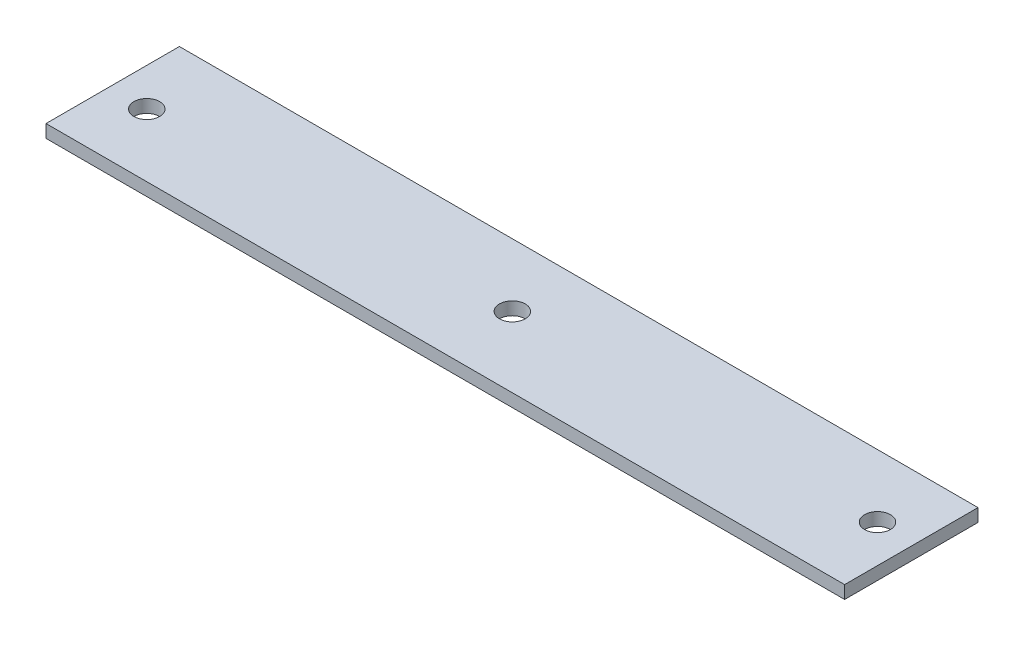
from build123d import *

# Parameters (mm, degrees)
SKETCH1_W           = 92.8
SKETCH1_H           = 15.5
SKETCH1_R           = 1.5
BOSS_EXTRUDE1_DEPTH = 1.5


with BuildPart() as part:
    # Sketch1 → Boss-Extrude1 (new body)
    with BuildSketch(Plane(origin=(0, 0, 0), x_dir=(1, 0, 0), z_dir=(0, 1, 0))):
        with Locations((0.332020049, 0.279548896)):
            Rectangle(SKETCH1_W, SKETCH1_H)
        with Locations(Location((-41.667979951, -0.160451104, 0), (0, 0, 270))):
            Circle(SKETCH1_R, mode=Mode.SUBTRACT)
        with Locations(Location((-0.067979951, 0.719548896, 0), (0, 0, 270))):
            Circle(SKETCH1_R, mode=Mode.SUBTRACT)
        with Locations(Location((42.352020049, 0.729548896, 0), (0, 0, 270))):
            Circle(SKETCH1_R, mode=Mode.SUBTRACT)
    extrude(amount=BOSS_EXTRUDE1_DEPTH)


solid = part.part
